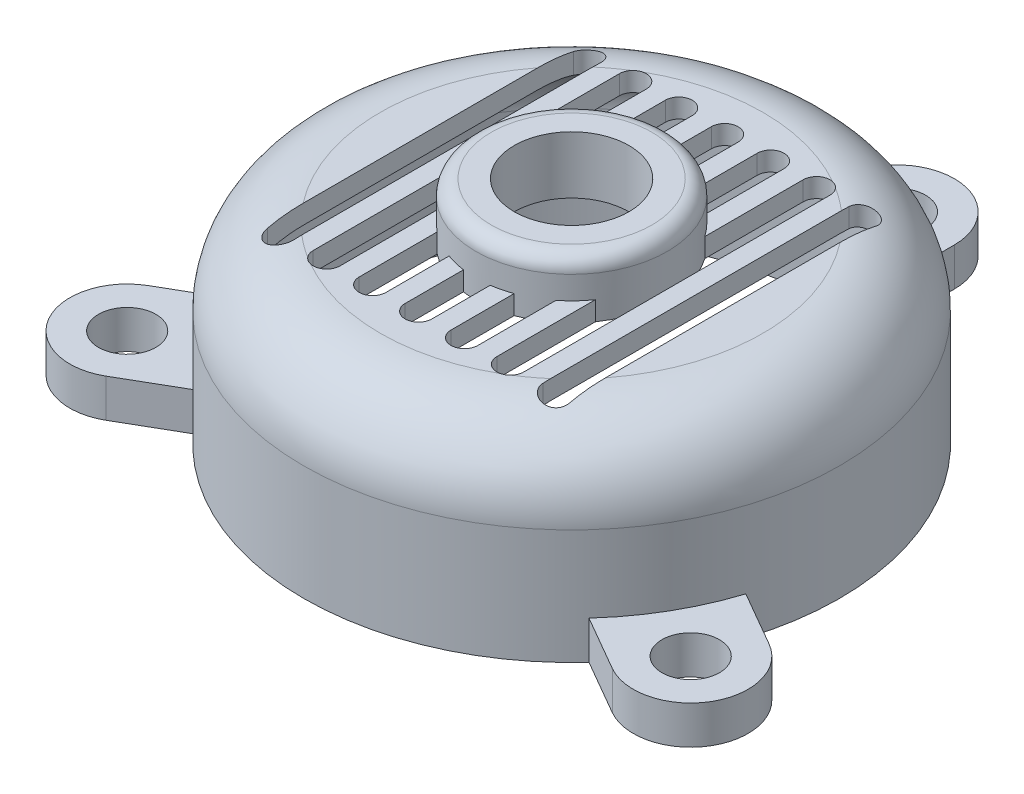
from build123d import *

# Parameters (mm, degrees)
SKETCH1_R                = 88.9
BOSS_EXTRUDE1_DEPTH      = 63.5
FILLET1_R                = 25.4
SHELL1_T                 = -6.35
SKETCH1_3_R              = 9.525
BOSS_EXTRUDE2_DEPTH      = 12.7
CUT_EXTRUDE1_REACH       = 183.179
BOSS_EXTRUDE3_DEPTH      = 12.7
BOSS_EXTRUDE3_DEPTH_BACK = 6.35
SKETCH4_R                = 31.75
SKETCH4_R_2              = 19.05
FILLET2_R                = 5.08
CUT_EXTRUDE2_START       = -6.35
SKETCH4_2_R              = 19.05
CUT_EXTRUDE2_DEPTH       = 6.35


with BuildPart() as part:
    # Sketch1 → Boss-Extrude1 (new body)
    with BuildSketch(Plane(origin=(0, 0, 0), x_dir=(1, 0, 0), z_dir=(0, 1, 0))):
        with Locations(Location((0, 0, 0), (0, 0, 270))):
            Circle(SKETCH1_R)
    extrude(amount=BOSS_EXTRUDE1_DEPTH)

    # Fillet1
    fillet1_edges = [part.edges().sort_by_distance(p)[0] for p in [
        (0, 63.5, -88.9),
    ]]
    fillet(fillet1_edges, radius=FILLET1_R)

    # Shell1
    shell1_openings = [part.faces().sort_by_distance(p)[0] for p in [
        (0, 0, 0),
    ]]
    offset(amount=SHELL1_T, openings=shell1_openings, kind=Kind.INTERSECTION)

    # Sketch1<3> → Boss-Extrude2 (add)
    # profile 1 of 3: a face of its own
    with BuildSketch(Plane(origin=(0, 0, 0), x_dir=(1, 0, 0), z_dir=(0, 1, 0))):
        with BuildLine():
            ThreePointArc((19.05, 107.95), (0, 127), (-19.05, 107.95))
            Line((-19.05, 107.95), (-19.05, 86.834944003))
            ThreePointArc((-19.05, 86.834944003), (0, 88.9), (19.05, 86.834944003))
            Line((19.05, 86.834944003), (19.05, 107.95))
        make_face()
        with Locations(Location((0, 107.95, 0), (0, 0, 270))):
            Circle(SKETCH1_3_R, mode=Mode.SUBTRACT)
    # profile 2 of 3: a face of its own
    with BuildSketch(Plane(origin=(0, 0, 0), x_dir=(1, 0, 0), z_dir=(0, 1, 0))):
        with BuildLine():
            ThreePointArc((-65.676267443, -59.915255944), (-76.989658396, -44.45), (-84.726267443, -26.919688059))
            Line((-84.726267443, -26.919688059), (-103.012442339, -37.477216058))
            ThreePointArc((-103.012442339, -37.477216058), (-109.985226281, -63.5), (-83.962442339, -70.472783942))
            Line((-83.962442339, -70.472783942), (-65.676267443, -59.915255944))
        make_face()
        with Locations(Location((-93.487442339, -53.975, 0), (0, 0, 270))):
            Circle(SKETCH1_3_R, mode=Mode.SUBTRACT)
    # profile 3 of 3: a face of its own
    with BuildSketch(Plane(origin=(0, 0, 0), x_dir=(1, 0, 0), z_dir=(0, 1, 0))):
        with BuildLine():
            Line((103.012442339, -37.477216058), (84.726267443, -26.919688059))
            ThreePointArc((84.726267443, -26.919688059), (76.989658396, -44.45), (65.676267443, -59.915255944))
            Line((65.676267443, -59.915255944), (83.962442339, -70.472783942))
            ThreePointArc((83.962442339, -70.472783942), (109.985226281, -63.5), (103.012442339, -37.477216058))
        make_face()
        with Locations(Location((93.487442339, -53.975, 0), (0, 0, 270))):
            Circle(SKETCH1_3_R, mode=Mode.SUBTRACT)
    extrude(amount=BOSS_EXTRUDE2_DEPTH)

    # Sketch3 → Cut-Extrude1 (cut, up to next)
    with BuildSketch(Plane(origin=(0, 63.5, 0), x_dir=(1, 0, 0), z_dir=(0, 1, 0)), mode=Mode.PRIVATE) as cut_extrude1_sk1:
        with BuildLine():
            Line((-34.925, 50.8), (-34.925, -50.8))
            ThreePointArc((-34.925, -50.8), (-30.48, -55.245), (-26.035, -50.8))
            Line((-26.035, -50.8), (-26.035, 50.8))
            ThreePointArc((-26.035, 50.8), (-30.48, 55.245), (-34.925, 50.8))
        make_face()
    cut_extrude1_tool1 = extrude(cut_extrude1_sk1.sketch, amount=-CUT_EXTRUDE1_REACH, mode=Mode.PRIVATE) & part.part
    # Sketch3 → Cut-Extrude1 (cut, up to next)
    with BuildSketch(Plane(origin=(0, 63.5, 0), x_dir=(1, 0, 0), z_dir=(0, 1, 0)), mode=Mode.PRIVATE) as cut_extrude1_sk2:
        with BuildLine():
            Line((-50.165, 50.8), (-50.165, -50.8))
            ThreePointArc((-50.165, -50.8), (-45.72, -55.245), (-41.275, -50.8))
            Line((-41.275, -50.8), (-41.275, 50.8))
            ThreePointArc((-41.275, 50.8), (-45.72, 55.245), (-50.165, 50.8))
        make_face()
    cut_extrude1_tool2 = extrude(cut_extrude1_sk2.sketch, amount=-CUT_EXTRUDE1_REACH, mode=Mode.PRIVATE) & part.part
    # Sketch3 → Cut-Extrude1 (cut, up to next)
    with BuildSketch(Plane(origin=(0, 63.5, 0), x_dir=(1, 0, 0), z_dir=(0, 1, 0)), mode=Mode.PRIVATE) as cut_extrude1_sk3:
        with BuildLine():
            Line((-19.685, 50.8), (-19.685, -50.8))
            ThreePointArc((-19.685, -50.8), (-15.24, -55.245), (-10.795, -50.8))
            Line((-10.795, -50.8), (-10.795, 50.8))
            ThreePointArc((-10.795, 50.8), (-15.24, 55.245), (-19.685, 50.8))
        make_face()
    cut_extrude1_tool3 = extrude(cut_extrude1_sk3.sketch, amount=-CUT_EXTRUDE1_REACH, mode=Mode.PRIVATE) & part.part
    # Sketch3 → Cut-Extrude1 (cut, up to next)
    with BuildSketch(Plane(origin=(0, 63.5, 0), x_dir=(1, 0, 0), z_dir=(0, 1, 0)), mode=Mode.PRIVATE) as cut_extrude1_sk4:
        with BuildLine():
            Line((-4.445, 50.8), (-4.445, -50.8))
            ThreePointArc((-4.445, -50.8), (0, -55.245), (4.445, -50.8))
            Line((4.445, -50.8), (4.445, 50.8))
            ThreePointArc((4.445, 50.8), (0, 55.245), (-4.445, 50.8))
        make_face()
    cut_extrude1_tool4 = extrude(cut_extrude1_sk4.sketch, amount=-CUT_EXTRUDE1_REACH, mode=Mode.PRIVATE) & part.part
    # Sketch3 → Cut-Extrude1 (cut, up to next)
    with BuildSketch(Plane(origin=(0, 63.5, 0), x_dir=(1, 0, 0), z_dir=(0, 1, 0)), mode=Mode.PRIVATE) as cut_extrude1_sk5:
        with BuildLine():
            Line((10.795, 50.8), (10.795, -50.8))
            ThreePointArc((10.795, -50.8), (15.24, -55.245), (19.685, -50.8))
            Line((19.685, -50.8), (19.685, 50.8))
            ThreePointArc((19.685, 50.8), (15.24, 55.245), (10.795, 50.8))
        make_face()
    cut_extrude1_tool5 = extrude(cut_extrude1_sk5.sketch, amount=-CUT_EXTRUDE1_REACH, mode=Mode.PRIVATE) & part.part
    # Sketch3 → Cut-Extrude1 (cut, up to next)
    with BuildSketch(Plane(origin=(0, 63.5, 0), x_dir=(1, 0, 0), z_dir=(0, 1, 0)), mode=Mode.PRIVATE) as cut_extrude1_sk6:
        with BuildLine():
            Line((26.035, 50.8), (26.035, -50.8))
            ThreePointArc((26.035, -50.8), (30.48, -55.245), (34.925, -50.8))
            Line((34.925, -50.8), (34.925, 50.8))
            ThreePointArc((34.925, 50.8), (30.48, 55.245), (26.035, 50.8))
        make_face()
    cut_extrude1_tool6 = extrude(cut_extrude1_sk6.sketch, amount=-CUT_EXTRUDE1_REACH, mode=Mode.PRIVATE) & part.part
    # Sketch3 → Cut-Extrude1 (cut, up to next)
    with BuildSketch(Plane(origin=(0, 63.5, 0), x_dir=(1, 0, 0), z_dir=(0, 1, 0)), mode=Mode.PRIVATE) as cut_extrude1_sk7:
        with BuildLine():
            Line((41.275, 50.8), (41.275, -50.8))
            ThreePointArc((41.275, -50.8), (45.72, -55.245), (50.165, -50.8))
            Line((50.165, -50.8), (50.165, 50.8))
            ThreePointArc((50.165, 50.8), (45.72, 55.245), (41.275, 50.8))
        make_face()
    cut_extrude1_tool7 = extrude(cut_extrude1_sk7.sketch, amount=-CUT_EXTRUDE1_REACH, mode=Mode.PRIVATE) & part.part
    add(cut_extrude1_tool1.solids().sort_by_distance((-30.48, 63.5, 0))[0], mode=Mode.SUBTRACT)
    add(cut_extrude1_tool2.solids().sort_by_distance((-45.72, 63.5, 0))[0], mode=Mode.SUBTRACT)
    add(cut_extrude1_tool3.solids().sort_by_distance((-15.24, 63.5, 0))[0], mode=Mode.SUBTRACT)
    add(cut_extrude1_tool4.solids().sort_by_distance((0, 63.5, 0))[0], mode=Mode.SUBTRACT)
    add(cut_extrude1_tool5.solids().sort_by_distance((15.24, 63.5, 0))[0], mode=Mode.SUBTRACT)
    add(cut_extrude1_tool6.solids().sort_by_distance((30.48, 63.5, 0))[0], mode=Mode.SUBTRACT)
    add(cut_extrude1_tool7.solids().sort_by_distance((45.72, 63.5, 0))[0], mode=Mode.SUBTRACT)

    # Sketch4 → Boss-Extrude3 (add, two sides: drawn at the far end of the back side and taken through both)
    with BuildSketch(Plane(origin=(0, 63.5, 0), x_dir=(1, 0, 0), z_dir=(0, 1, 0)).offset(-BOSS_EXTRUDE3_DEPTH_BACK)):
        with Locations(Location((0, 0, 0), (0, 0, 270))):
            Circle(SKETCH4_R)
        with Locations(Location((0, 0, 0), (0, 0, 270))):
            Circle(SKETCH4_R_2, mode=Mode.SUBTRACT)
    extrude(amount=BOSS_EXTRUDE3_DEPTH + BOSS_EXTRUDE3_DEPTH_BACK)

    # Fillet2
    fillet2_edges = [part.edges().sort_by_distance(p)[0] for p in [
        (0, 76.2, -31.75),
    ]]
    fillet(fillet2_edges, radius=FILLET2_R)

    # Sketch4<2> → Cut-Extrude2 (cut)
    with BuildSketch(Plane(origin=(0, 63.5, 0), x_dir=(1, 0, 0), z_dir=(0, 1, 0)).offset(CUT_EXTRUDE2_START)):
        with Locations(Location((0, 0, 0), (0, 0, 270))):
            Circle(SKETCH4_2_R)
    extrude(amount=CUT_EXTRUDE2_DEPTH, mode=Mode.SUBTRACT)


solid = part.part
